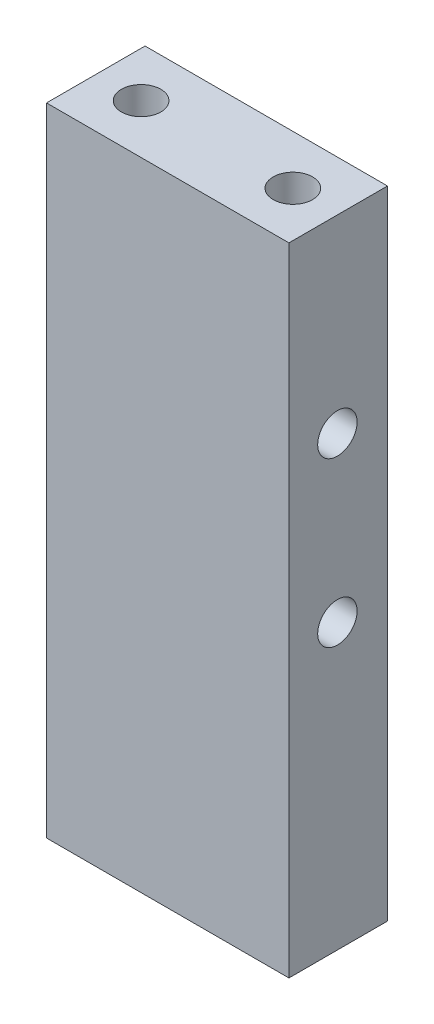
from build123d import *

# Parameters (mm, degrees)
SKETCH1_W           = 12.3
SKETCH1_H           = 32.3
BOSS_EXTRUDE1_DEPTH = 5
SKETCH3_R           = 1
CUT_EXTRUDE1_DEPTH  = 285.989327178
SKETCH4_R           = 1
CUT_EXTRUDE2_DEPTH  = 249.777773307


with BuildPart() as part:
    # Sketch1 → Boss-Extrude1 (new body)
    with BuildSketch(Plane.XY.offset(6)):
        with Locations((-240.276643226, 268.361206467)):
            Rectangle(SKETCH1_W, SKETCH1_H)
    extrude(amount=BOSS_EXTRUDE1_DEPTH)

    # Sketch3 → Cut-Extrude1 (cut, through all)
    with BuildSketch(Plane.ZY.offset(246.426643226)):
        with Locations((8.542189851, 274.911206467)):
            Circle(SKETCH3_R)
        with Locations((8.542189851, 266.611206467)):
            Circle(SKETCH3_R)
    extrude(amount=-CUT_EXTRUDE1_DEPTH, mode=Mode.SUBTRACT)

    # Sketch4 → Cut-Extrude2 (cut, through all)
    with BuildSketch(Plane(origin=(0, 252.211206467, 0), x_dir=(-1, 0, 0), z_dir=(0, -1, 0))):
        with Locations(Location((244.126643226, -8.5, 0), (0, 0, 90))):
            Circle(SKETCH4_R)
        with Locations(Location((236.426643226, -8.5, 0), (0, 0, 90))):
            Circle(SKETCH4_R)
    extrude(amount=-CUT_EXTRUDE2_DEPTH, mode=Mode.SUBTRACT)


solid = part.part
